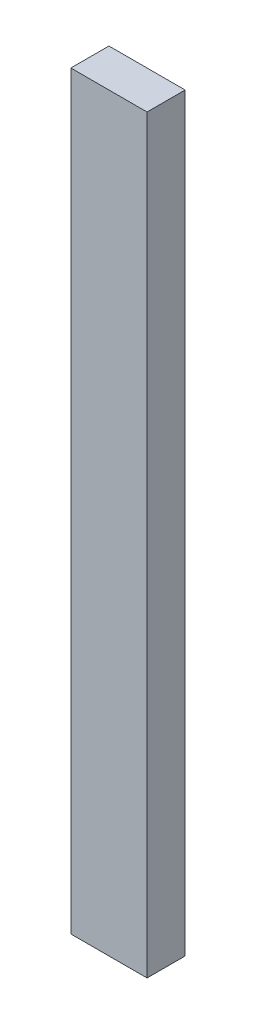
from build123d import *

# Parameters (mm, degrees)
SKETCH1_W           = 50.8
SKETCH1_H           = 25.4
BOSS_EXTRUDE1_DEPTH = 250


with BuildPart() as part:
    # Sketch1 → Boss-Extrude1 (new, symmetric)
    with BuildSketch(Plane(origin=(0, 0, 0), x_dir=(1, 0, 0), z_dir=(0, 1, 0))):
        Rectangle(SKETCH1_W, SKETCH1_H)
    extrude(amount=BOSS_EXTRUDE1_DEPTH, both=True)


solid = part.part
